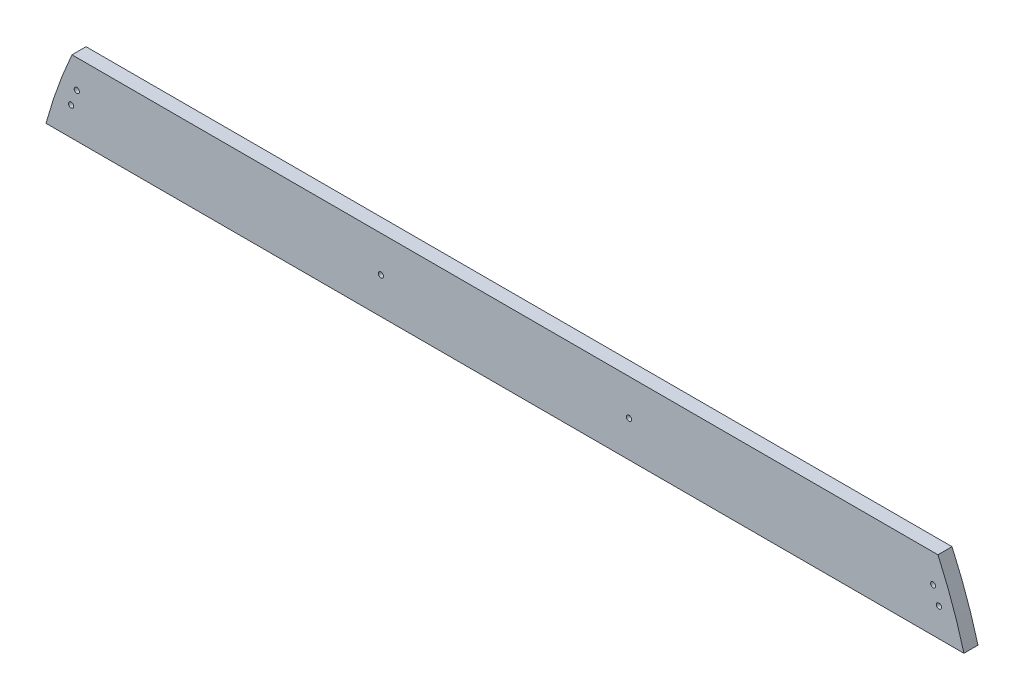
from build123d import *

# Parameters (mm, degrees)
SKETCH1_R           = 3.175
BOSS_EXTRUDE1_DEPTH = 17.272
CUT_EXTRUDE2_REACH  = 615.668
SKETCH3_R           = 3.175


with BuildPart() as part:
    # Sketch1 → Boss-Extrude1 (new body)
    with BuildSketch(Plane.XY):
        with BuildLine():
            Line((-563.971524104, 152.4), (563.971524104, 152.4))
            ThreePointArc((563.971524104, 152.4), (549.804304053, 197.496499323), (532.037545668, 241.3))
            Line((532.037545668, 241.3), (-532.037545668, 241.3))
            ThreePointArc((-532.037545668, 241.3), (-549.804304053, 197.496499323), (-563.971524104, 152.4))
        make_face()
        with Locations((533.201525575, 187.325)):
            Circle(SKETCH1_R, mode=Mode.SUBTRACT)
        with Locations((526.121546674, 206.375)):
            Circle(SKETCH1_R, mode=Mode.SUBTRACT)
        with Locations((-533.201525575, 187.325)):
            Circle(SKETCH1_R, mode=Mode.SUBTRACT)
        with Locations((-526.121546674, 206.375)):
            Circle(SKETCH1_R, mode=Mode.SUBTRACT)
    extrude(amount=BOSS_EXTRUDE1_DEPTH)

    # Sketch3 → Cut-Extrude2 (cut, up to next)
    with BuildSketch(Plane.XY.offset(17.272), mode=Mode.PRIVATE) as cut_extrude2_sk1:
        with Locations((152.4, 196.85)):
            Circle(SKETCH3_R)
    cut_extrude2_tool1 = extrude(cut_extrude2_sk1.sketch, amount=-CUT_EXTRUDE2_REACH, mode=Mode.PRIVATE) & part.part
    # Sketch3 → Cut-Extrude2 (cut, up to next)
    with BuildSketch(Plane.XY.offset(17.272), mode=Mode.PRIVATE) as cut_extrude2_sk2:
        with Locations((-152.4, 196.85)):
            Circle(SKETCH3_R)
    cut_extrude2_tool2 = extrude(cut_extrude2_sk2.sketch, amount=-CUT_EXTRUDE2_REACH, mode=Mode.PRIVATE) & part.part
    add(cut_extrude2_tool1.solids().sort_by_distance((152.4, 196.85, 17.272))[0], mode=Mode.SUBTRACT)
    add(cut_extrude2_tool2.solids().sort_by_distance((-152.4, 196.85, 17.272))[0], mode=Mode.SUBTRACT)


solid = part.part
